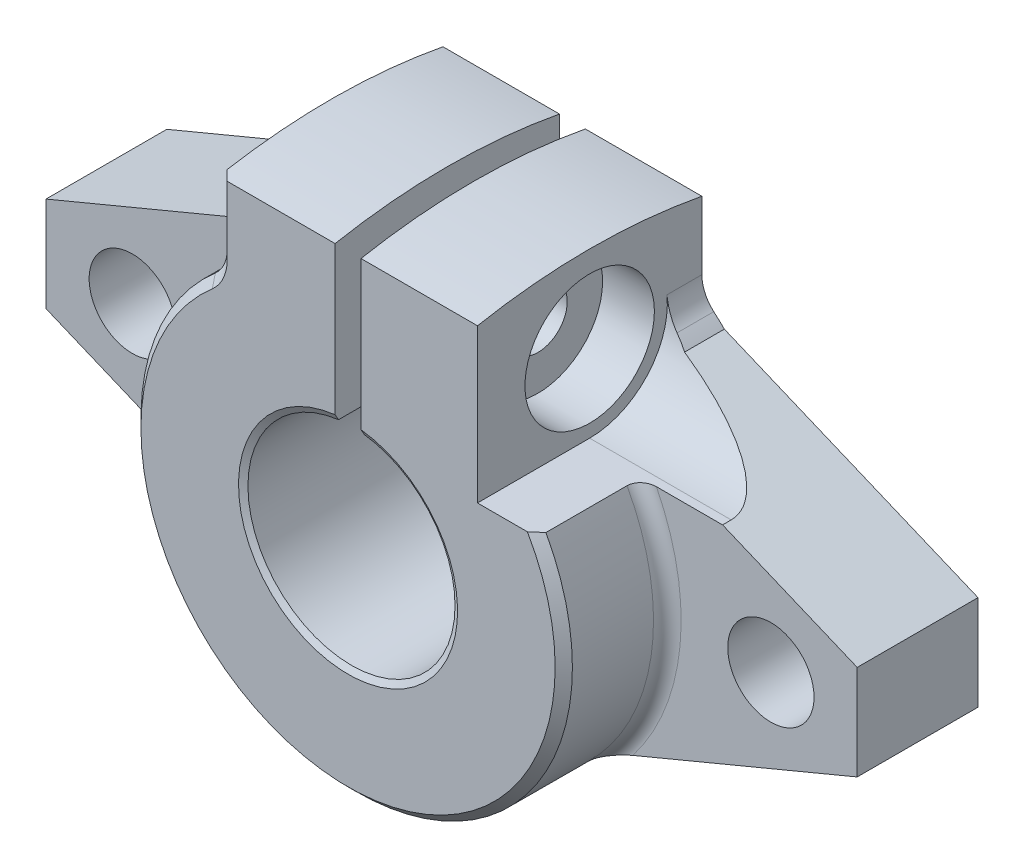
from build123d import *

# Parameters (mm, degrees)
BOSS_EXTRUDE1_DEPTH                                 = 13
CUT_EXTRUDE1_DEPTH                                  = 24.780243901
CUT_EXTRUDE1_DEPTH_BACK                             = 24.780243901
FILLET1_R                                           = 2
BOSS_EXTRUDE2_DEPTH                                 = 7
HOLE_WIZARD_5_0_5_1_D                               = 5
HOLE_WIZARD_5_0_5_1_DEPTH                           = 10
HOLE_WIZARD_5_0_5_1_TIP                             = 1.502151548
CUT_EXTRUDE2_REACH                                  = 39.017
CBORE_FOR_M4_HEX_SOCKET_HEAD_CAP_SCREW3_D           = 3.4
CBORE_FOR_M4_HEX_SOCKET_HEAD_CAP_SCREW3_CBORE_D     = 7.5
CBORE_FOR_M4_HEX_SOCKET_HEAD_CAP_SCREW3_CBORE_DEPTH = 3
CHAMFER2_SIZE                                       = 0.5
FILLET2_R                                           = 0.8
CHAMFER3_SIZE                                       = 0.2
CHAMFER3_SIZE2                                      = 0.346410162


with BuildPart() as part:
    # Sketch1 → Boss-Extrude1 (new body)
    with BuildSketch(Plane.XY):
        with BuildLine():
            Line((0.75, 5.95294045), (0.75, 15.5))
            Line((0.75, 15.5), (7.5, 15.5))
            Line((7.5, 15.5), (7.5, 10))
            ThreePointArc((7.5, 10), (0, -12.5), (-7.5, 10))
            Line((-7.5, 10), (-7.5, 15.5))
            Line((-7.5, 15.5), (-0.75, 15.5))
            Line((-0.75, 15.5), (-0.75, 5.95294045))
            ThreePointArc((-0.75, 5.95294045), (0, -6), (0.75, 5.95294045))
        make_face()
    extrude(amount=BOSS_EXTRUDE1_DEPTH)

    # Sketch2 → Cut-Extrude1 (cut, two sides: drawn at the far end of the back side and taken through both)
    with BuildSketch(Plane(origin=(0, 0, 0), x_dir=(0, 0, -1), z_dir=(1, 0, 0)).offset(-CUT_EXTRUDE1_DEPTH_BACK)):
        with BuildLine():
            Line((69.410215856, 1.772448509), (0, 14.891132578))
            ThreePointArc((0, 14.891132578), (-6.5, 15.5), (-13, 14.891132578))
            Line((-13, 14.891132578), (-82.410215856, 1.772448509))
            Line((-82.410215856, 1.772448509), (-82.410215856, 143.050584636))
            Line((-82.410215856, 143.050584636), (69.410215856, 143.050584636))
            Line((69.410215856, 143.050584636), (69.410215856, 1.772448509))
        make_face()
    extrude(amount=CUT_EXTRUDE1_DEPTH + CUT_EXTRUDE1_DEPTH_BACK, mode=Mode.SUBTRACT)

    # Fillet1
    fillet1_edges = [part.edges().sort_by_distance(p)[0] for p in [
        (7.5, 10, 6.5),
        (-7.5, 10, 6.5),
    ]]
    fillet(fillet1_edges, radius=FILLET1_R)

    # Sketch3 → Boss-Extrude2 (add)
    with BuildSketch(Plane.XY):
        with BuildLine():
            Line((8.803538255, 8.873990883), (23.5, 2.75))
            Line((23.5, 2.75), (23.5, -2.75))
            Line((23.5, -2.75), (8.803538255, -8.873990883))
            ThreePointArc((8.803538255, -8.873990883), (12.5, 0), (8.803538255, 8.873990883))
        make_face()
    extrude(amount=BOSS_EXTRUDE2_DEPTH)

    # Mirror1: part across plane


with BuildPart() as part_1:
    add(part.part)
    add(part.part.mirror(Plane(origin=(0, 0, 0), x_dir=(0, 0, 1), z_dir=(1, 0, 0))))

    # Диаметр отверстия Ø5.0 (5)1
    with Locations(Plane.XY.offset(7)):
        with Locations((18.5, 0), (-18.5, 0)):
            Hole(HOLE_WIZARD_5_0_5_1_D / 2, depth=HOLE_WIZARD_5_0_5_1_DEPTH)
            with Locations((0, 0, -(HOLE_WIZARD_5_0_5_1_DEPTH + HOLE_WIZARD_5_0_5_1_TIP / 2))):  # 118° drill point
                Cone(0, HOLE_WIZARD_5_0_5_1_D / 2, HOLE_WIZARD_5_0_5_1_TIP, mode=Mode.SUBTRACT)

    # Sketch9 → Cut-Extrude2 (cut, up to next)
    with BuildSketch(Plane(origin=(7.5, 0, 0), x_dir=(0, 0, -1), z_dir=(1, 0, 0)), mode=Mode.PRIVATE) as cut_extrude2_sk1:
        with BuildLine():
            Line((-2.023006126, 10.95445115), (-13, 10.95445115))
            Line((-13, 10.95445115), (-13, 6))
            Line((-13, 6), (-6.5, 6))
            ThreePointArc((-6.5, 6), (-3.161210536, 7.482967532), (-2.023006126, 10.95445115))
        make_face()
    cut_extrude2_tool1 = extrude(cut_extrude2_sk1.sketch, amount=CUT_EXTRUDE2_REACH, mode=Mode.PRIVATE) & part_1.part
    add(cut_extrude2_tool1.solids().sort_by_distance((7.5, 8.604622, 7.889878))[0], mode=Mode.SUBTRACT)

    # CBORE for M4 Hex Socket Head Cap Screw3 (through all)
    with Locations(Plane(origin=(7.5, 0, 0), x_dir=(0, 0, -1), z_dir=(1, 0, 0))):
        with Locations((-6.5, 10.5)):
            CounterBoreHole(CBORE_FOR_M4_HEX_SOCKET_HEAD_CAP_SCREW3_D / 2, CBORE_FOR_M4_HEX_SOCKET_HEAD_CAP_SCREW3_CBORE_D / 2, CBORE_FOR_M4_HEX_SOCKET_HEAD_CAP_SCREW3_CBORE_DEPTH)

    # Chamfer2
    chamfer2_edges = [part_1.edges().sort_by_distance(p)[0] for p in [
        (-7.5, 12.922791864, 13),
        (-2.211613172, -12.302795096, 13),
        (-7.680564695, 10.123996352, 13),
    ]]
    chamfer(chamfer2_edges, length=CHAMFER2_SIZE)

    # Fillet2
    fillet2_edges = [part_1.edges().sort_by_distance(p)[0] for p in [
        (12.36996926, -1.798293779, 7),
        (8.803538255, -8.873990883, 3.5),
        (-12.5, 0, 7),
        (-8.803538255, -8.873990883, 3.5),
    ]]
    fillet(fillet2_edges, radius=FILLET2_R)

    # Chamfer3
    chamfer3_edges = [part_1.edges().sort_by_distance(p)[0] for p in [
        (0, -6, 13),
    ]]
    chamfer3_side = [part_1.faces().sort_by_distance(p)[0] for p in [
        (0, -6, 6.5),
    ]]
    chamfer(chamfer3_edges, length=CHAMFER3_SIZE, length2=CHAMFER3_SIZE2, reference=chamfer3_side[0])


solid = part_1.part
